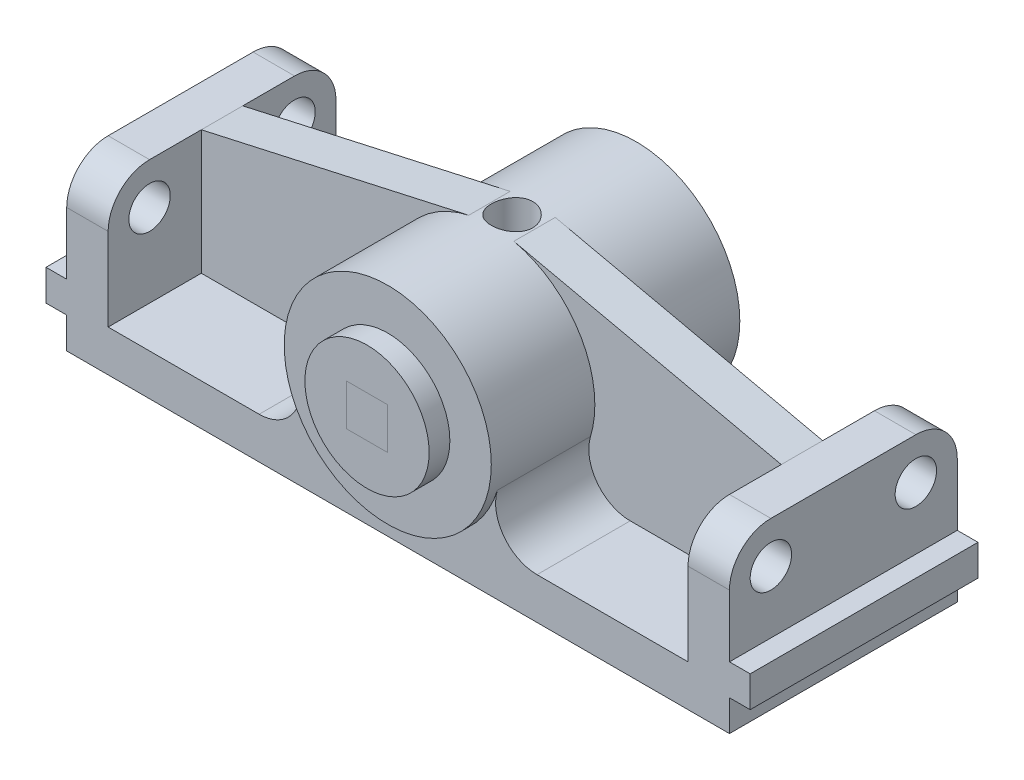
from build123d import *

# Parameters (mm, degrees)
SKETCH1_R               = 31.75
BOSS_EXTRUDE1_DEPTH     = 38.1
BOSS_EXTRUDE3_DEPTH     = 34.925
RIB2_REACH              = 122.65
SKETCH5_WALL_W          = 327.302604126
SKETCH5_WALL_H          = 12.7
SKETCH10_R              = 19.05
CUT_EXTRUDE5_DEPTH      = 44.45
SKETCH6_R               = 19.05
BOSS_EXTRUDE8_DEPTH     = 44.45
SKETCH7_W               = 12.7
SKETCH7_H               = 12.7
CUT_EXTRUDE6_DEPTH      = 44.45
SKETCH7_2_W             = 12.7
SKETCH7_2_H             = 12.7
BOSS_EXTRUDE9_DEPTH     = 44.45
CUT_EXTRUDE7_REACH      = 219.574
SKETCH13_R              = 6.35
CUT_EXTRUDE8_REACH      = 219.574
MIRROR4_COPY_1_REACH    = 219.574
CUT_EXTRUDE9_DEPTH      = 123.803155497
CUT_EXTRUDE9_DEPTH_BACK = 123.803155497
SKETCH15_R              = 6.35


with BuildPart() as part:
    # Sketch1 → Boss-Extrude1 (new, symmetric)
    with BuildSketch(Plane.XY):
        with Locations(Location((0, 0, 0), (0, 0, 180))):
            Circle(SKETCH1_R)
    extrude(amount=BOSS_EXTRUDE1_DEPTH, both=True)

    # Sketch4 → Boss-Extrude3 (add, symmetric)
    with BuildSketch(Plane.XY):
        with BuildLine():
            Line((-101.6, 12.7), (-101.6, -19.05))
            Line((-101.6, -19.05), (-107.95, -19.05))
            Line((-107.95, -19.05), (-107.95, -28.575))
            Line((-107.95, -28.575), (-101.6, -28.575))
            Line((-101.6, -28.575), (-101.6, -38.1))
            Line((-101.6, -38.1), (101.6, -38.1))
            Line((101.6, -38.1), (101.6, -28.575))
            Line((101.6, -28.575), (107.95, -28.575))
            Line((107.95, -28.575), (107.95, -19.05))
            Line((107.95, -19.05), (101.6, -19.05))
            Line((101.6, -19.05), (101.6, 12.7))
            Line((101.6, 12.7), (88.9, 12.7))
            Line((88.9, 12.7), (88.9, -25.4))
            Line((88.9, -25.4), (42.597094971, -25.4))
            ThreePointArc((42.597094971, -25.4), (32.414441655, -20.289701669), (30.426496408, -9.071428571))
            ThreePointArc((30.426496408, -9.071428571), (0, -31.75), (-30.426496408, -9.071428571))
            ThreePointArc((-30.426496408, -9.071428571), (-32.414441655, -20.289701669), (-42.597094971, -25.4))
            Line((-42.597094971, -25.4), (-88.9, -25.4))
            Line((-88.9, -25.4), (-88.9, 12.7))
            Line((-88.9, 12.7), (-101.6, 12.7))
        make_face()
    extrude(amount=BOSS_EXTRUDE3_DEPTH, both=True)

    # Sketch5 wall → Rib2 (add, up to next)
    with BuildSketch(Plane(origin=(-47.906184897, 21.844205722, 0), x_dir=(0.976012958873, 0.217712434445, 0), z_dir=(-0.217712434445, 0.976012958873, 0)), mode=Mode.PRIVATE) as rib2_sk1:
        Rectangle(SKETCH5_WALL_W, SKETCH5_WALL_H)
    rib2_tool1 = extrude(rib2_sk1.sketch, amount=-RIB2_REACH, mode=Mode.PRIVATE) - part.part
    rib2 = rib2_tool1.solids().sort_by_distance((-47.906184897, 21.844205722, 0))[0]
    add(rib2)

    # Mirror1: Rib2 across plane
    add(rib2.mirror(Plane(origin=(0, 0, 0), x_dir=(0, 0, 1), z_dir=(1, 0, 0))))

    # Sketch10 → Cut-Extrude5 (cut, symmetric)
    with BuildSketch(Plane.XY):
        Circle(SKETCH10_R)
    extrude(amount=CUT_EXTRUDE5_DEPTH, both=True, mode=Mode.SUBTRACT)

    # Sketch13 → Cut-Extrude7 (cut, up to next)
    with BuildSketch(Plane(origin=(101.6, 0, 0), x_dir=(0, 0, -1), z_dir=(1, 0, 0)), mode=Mode.PRIVATE) as cut_extrude7_sk1:
        with Locations((-22.225, 0)):
            Circle(SKETCH13_R)
    cut_extrude7_tool1 = extrude(cut_extrude7_sk1.sketch, amount=-CUT_EXTRUDE7_REACH, mode=Mode.PRIVATE) & part.part
    # Sketch13 → Cut-Extrude7 (cut, up to next)
    with BuildSketch(Plane(origin=(101.6, 0, 0), x_dir=(0, 0, -1), z_dir=(1, 0, 0)), mode=Mode.PRIVATE) as cut_extrude7_sk2:
        with Locations((22.225, 0)):
            Circle(SKETCH13_R)
    cut_extrude7_tool2 = extrude(cut_extrude7_sk2.sketch, amount=-CUT_EXTRUDE7_REACH, mode=Mode.PRIVATE) & part.part
    cut_extrude7_1 = cut_extrude7_tool1.solids().sort_by_distance((101.6, 0, 22.225))[0]
    add(cut_extrude7_1, mode=Mode.SUBTRACT)
    cut_extrude7_2 = cut_extrude7_tool2.solids().sort_by_distance((101.6, 0, -22.225))[0]
    add(cut_extrude7_2, mode=Mode.SUBTRACT)
    cut_extrude7 = cut_extrude7_1 + cut_extrude7_2  # Cut-Extrude7 as one shape, for the pattern or mirror that repeats it

    # Mirror2: Cut-Extrude7 across plane
    add(cut_extrude7.mirror(Plane(origin=(0, 0, 0), x_dir=(0, 0, 1), z_dir=(1, 0, 0))), mode=Mode.SUBTRACT)

    # Sketch14 → Cut-Extrude8 (cut, up to next)
    with BuildSketch(Plane(origin=(101.6, 0, 0), x_dir=(0, 0, -1), z_dir=(1, 0, 0)), mode=Mode.PRIVATE) as cut_extrude8_sk1:
        with BuildLine():
            Line((-34.925, 12.7), (-22.225, 12.7))
            ThreePointArc((-22.225, 12.7), (-31.205256121, 8.980256121), (-34.925, 0))
            Line((-34.925, 0), (-34.925, 12.7))
        make_face()
    cut_extrude8_tool1 = extrude(cut_extrude8_sk1.sketch, amount=-CUT_EXTRUDE8_REACH, mode=Mode.PRIVATE) & part.part
    cut_extrude8 = cut_extrude8_tool1.solids().sort_by_distance((101.6, 9.863227, 32.088227))[0]
    add(cut_extrude8, mode=Mode.SUBTRACT)

    # Mirror3: Cut-Extrude8 across plane
    add(cut_extrude8.mirror(Plane.XY), mode=Mode.SUBTRACT)

    # Mirror4: Cut-Extrude8 across plane
    add(cut_extrude8.mirror(Plane(origin=(0, 0, 0), x_dir=(0, 0, 1), z_dir=(1, 0, 0))), mode=Mode.SUBTRACT)

    # Mirror4 copy 1 sketch → Mirror4 copy 1 (cut, up to next)
    with BuildSketch(Plane.ZY.offset(101.6), mode=Mode.PRIVATE) as mirror4_copy_1_sk1:
        with BuildLine():
            Line((-34.925, 12.7), (-22.225, 12.7))
            ThreePointArc((-22.225, 12.7), (-31.205256121, 8.980256121), (-34.925, 0))
            Line((-34.925, 0), (-34.925, 12.7))
        make_face()
    mirror4_copy_1_tool1 = extrude(mirror4_copy_1_sk1.sketch, amount=-MIRROR4_COPY_1_REACH, mode=Mode.PRIVATE) & part.part
    add(mirror4_copy_1_tool1.solids().sort_by_distance((-101.6, 9.863227, -32.088227))[0], mode=Mode.SUBTRACT)


with BuildPart() as body_2:
    # Sketch6 → Boss-Extrude8 (new, symmetric)
    with BuildSketch(Plane.XY):
        Circle(SKETCH6_R)
    extrude(amount=BOSS_EXTRUDE8_DEPTH, both=True)

    # Sketch7 → Cut-Extrude6 (cut, symmetric)
    with BuildSketch(Plane.XY):
        Rectangle(SKETCH7_W, SKETCH7_H)
    extrude(amount=CUT_EXTRUDE6_DEPTH, both=True, mode=Mode.SUBTRACT)


with BuildPart() as body_3:
    # Sketch7<2> → Boss-Extrude9 (new, symmetric)
    with BuildSketch(Plane.XY):
        Rectangle(SKETCH7_2_W, SKETCH7_2_H)
    extrude(amount=BOSS_EXTRUDE9_DEPTH, both=True)


with BuildPart() as cut_extrude9_tool:
    # Sketch15 → Cut-Extrude9 (new, two sides: drawn at the far end of the back side and taken through both)
    with BuildSketch(Plane(origin=(0, 0, 0), x_dir=(1, 0, 0), z_dir=(0, 1, 0)).offset(-CUT_EXTRUDE9_DEPTH_BACK)):
        with Locations(Location((0, 0, 0), (0, 0, 270))):
            Circle(SKETCH15_R)
    extrude(amount=CUT_EXTRUDE9_DEPTH + CUT_EXTRUDE9_DEPTH_BACK)


with BuildPart() as body_2_1:
    add(body_2.part)

    # Cut-Extrude9: cut by cut_extrude9_tool
    add(cut_extrude9_tool.part, mode=Mode.SUBTRACT)


with BuildPart() as part_1:
    add(part.part)

    # Cut-Extrude9: cut by cut_extrude9_tool
    add(cut_extrude9_tool.part, mode=Mode.SUBTRACT)


solid = Compound([body_3.part, body_2_1.part, part_1.part])
